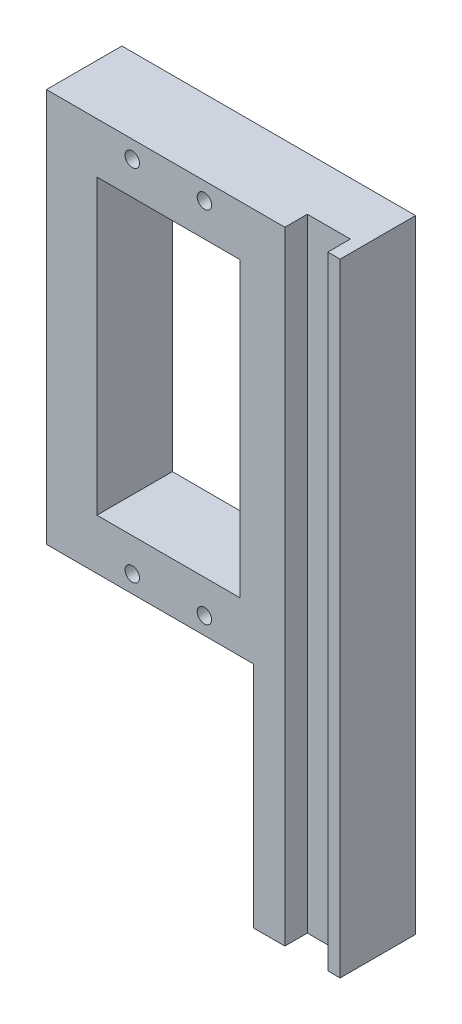
from build123d import *

# Parameters (mm, degrees)
BOSS_EXTRUDE2_DEPTH = 10.46
CUT_EXTRUDE1_DEPTH  = 3.12
SKETCH5_R           = 1
CUT_EXTRUDE2_DEPTH  = 20


with BuildPart() as part:
    # Sketch2 → Boss-Extrude2 (new body)
    with BuildSketch(Plane.XY):
        Polygon((-7.9, 27.3), (23.813102619, 27.3), (23.813102619, -59.002149985), (11.813102619, -59.002149985), (11.813102619, -27.3), (-2.175, -27.3), (-16.9, -27.3), (-16.9, 27.3), align=None)
        Polygon((-9.9, -20.3), (9.9, -20.3), (9.9, -19.3), (9.9, 20.3), (-9.9, 20.3), align=None, mode=Mode.SUBTRACT)
    extrude(amount=BOSS_EXTRUDE2_DEPTH)

    # Sketch4 → Cut-Extrude1 (cut)
    with BuildSketch(Plane.XY.offset(10.46)):
        Polygon((17.813102619, -59.002149985), (17.2, -59.002149985), (16.150910181, -59.002149985), (16.150910181, 27.3), (17.2, 27.3), (22.113102619, 27.3), (22.113102619, -59.002149985), align=None)
    extrude(amount=-CUT_EXTRUDE1_DEPTH, mode=Mode.SUBTRACT)

    # Sketch5 → Cut-Extrude2 (cut)
    with BuildSketch(Plane.XY.offset(10.46)):
        with Locations((-5, -24.9)):
            Circle(SKETCH5_R)
        with Locations((5, -24.9)):
            Circle(SKETCH5_R)
        with Locations((-5, 24.89)):
            Circle(SKETCH5_R)
        with Locations((5, 24.89)):
            Circle(SKETCH5_R)
    extrude(amount=-CUT_EXTRUDE2_DEPTH, mode=Mode.SUBTRACT)


solid = part.part
